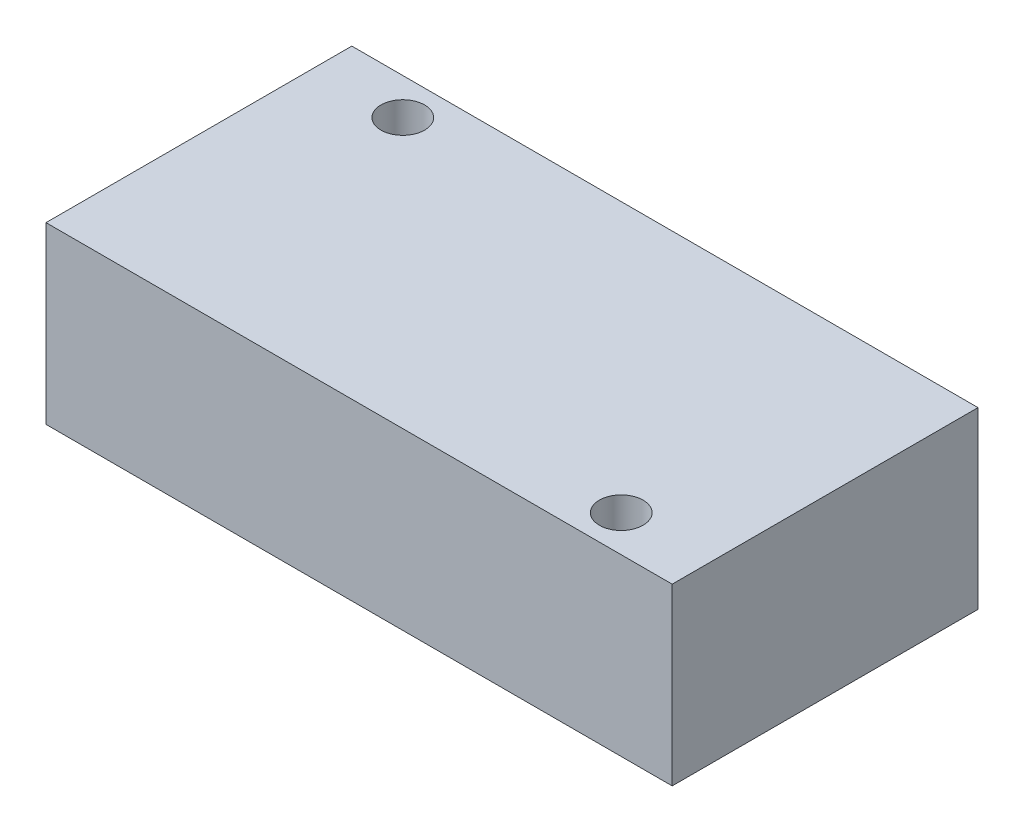
from build123d import *

# Parameters (mm, degrees)
SKETCH_1_W      = 43
SKETCH_1_H      = 21
SKETCH_1_R      = 1.5
EXTRUDE_1_DEPTH = 12


with BuildPart() as part:
    # 草圖1 → 填料-伸長1 (new body)
    with BuildSketch(Plane(origin=(0, 0, 0), x_dir=(1, 0, 0), z_dir=(0, 1, 0))):
        Rectangle(SKETCH_1_W, SKETCH_1_H)
        with Locations(Location((-15.5, 8, 0), (0, 0, 270))):
            Circle(SKETCH_1_R, mode=Mode.SUBTRACT)
        with Locations(Location((15.5, -8, 0), (0, 0, 270))):
            Circle(SKETCH_1_R, mode=Mode.SUBTRACT)
    extrude(amount=EXTRUDE_1_DEPTH)


solid = part.part
